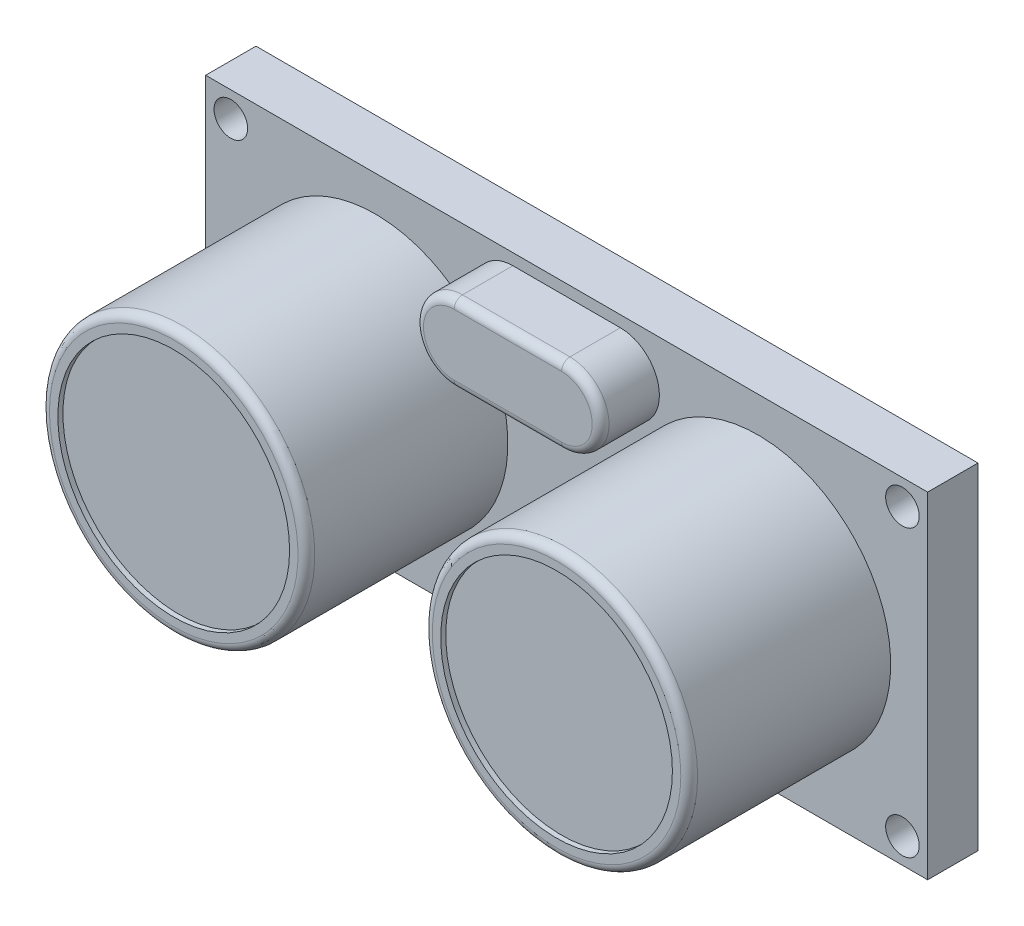
from build123d import *

# Parameters (mm, degrees)
SKETCH_1_W               = 43
SKETCH_1_H               = 20
EXTRUDE_1_DEPTH          = 3
CUT_EXTRUDE_1_DEPTH      = 24.900836805
CUT_EXTRUDE_1_DEPTH_BACK = 24.900836805
SKETCH_2_R               = 1
SKETCH_3_R               = 7.9
EXTRUDE_2_DEPTH          = 12
FILLET_1_R               = 0.5
SKETCH_5_R               = 6.9
CUT_EXTRUDE_2_DEPTH      = 0.3
EXTRUDE_3_DEPTH          = 3.5
FILLET_2_R               = 0.5


with BuildPart() as part:
    # 스케치1 → 보스-돌출1 (new body)
    with BuildSketch(Plane.XY):
        Rectangle(SKETCH_1_W, SKETCH_1_H)
    extrude(amount=EXTRUDE_1_DEPTH)

    # 스케치2 → 컷-돌출1 (cut, two sides: drawn at the far end of the back side and taken through both)
    with BuildSketch(Plane.XY.offset(3).offset(-CUT_EXTRUDE_1_DEPTH_BACK)):
        with Locations((20, 8.5)):
            Circle(SKETCH_2_R)
        with Locations(Location((-20, 8.5, 0), (0, 0, 180))):
            Circle(SKETCH_2_R)
        with Locations(Location((20, -8.5, 0), (0, 0, 180))):
            Circle(SKETCH_2_R)
        with Locations((-20, -8.5)):
            Circle(SKETCH_2_R)
    extrude(amount=CUT_EXTRUDE_1_DEPTH + CUT_EXTRUDE_1_DEPTH_BACK, mode=Mode.SUBTRACT)

    # 스케치3 → 보스-돌출2 (add)
    with BuildSketch(Plane.XY.offset(3)):
        with Locations(Location((11.4, 0, 0), (0, 0, 180))):
            Circle(SKETCH_3_R)
        with Locations(Location((-11.4, 0, 0), (0, 0, 180))):
            Circle(SKETCH_3_R)
    extrude(amount=EXTRUDE_2_DEPTH)

    # 필렛1
    fillet_1_edges = [part.edges().sort_by_distance(p)[0] for p in [
        (19.3, 0, 15),
        (-3.5, 0, 15),
    ]]
    fillet(fillet_1_edges, radius=FILLET_1_R)

    # 스케치5 → 컷-돌출2 (cut)
    with BuildSketch(Plane.XY.offset(15)):
        with Locations((-11.4, 0)):
            Circle(SKETCH_5_R)
        with Locations((11.4, 0)):
            Circle(SKETCH_5_R)
    extrude(amount=-CUT_EXTRUDE_2_DEPTH, mode=Mode.SUBTRACT)

    # 스케치6 → 보스-돌출3 (add)
    with BuildSketch(Plane.XY.offset(3)):
        with BuildLine():
            Line((-3.2, 9.325), (3.2, 9.325))
            ThreePointArc((3.2, 9.325), (5.525, 7), (3.2, 4.675))
            Line((3.2, 4.675), (-3.2, 4.675))
            ThreePointArc((-3.2, 4.675), (-5.525, 7), (-3.2, 9.325))
        make_face()
    extrude(amount=EXTRUDE_3_DEPTH)

    # 필렛2
    fillet_2_edges = [part.edges().sort_by_distance(p)[0] for p in [
        (-5.525, 7, 6.5),
        (0, 4.675, 6.5),
        (5.525, 7, 6.5),
        (0, 9.325, 6.5),
    ]]
    fillet(fillet_2_edges, radius=FILLET_2_R)


solid = part.part
